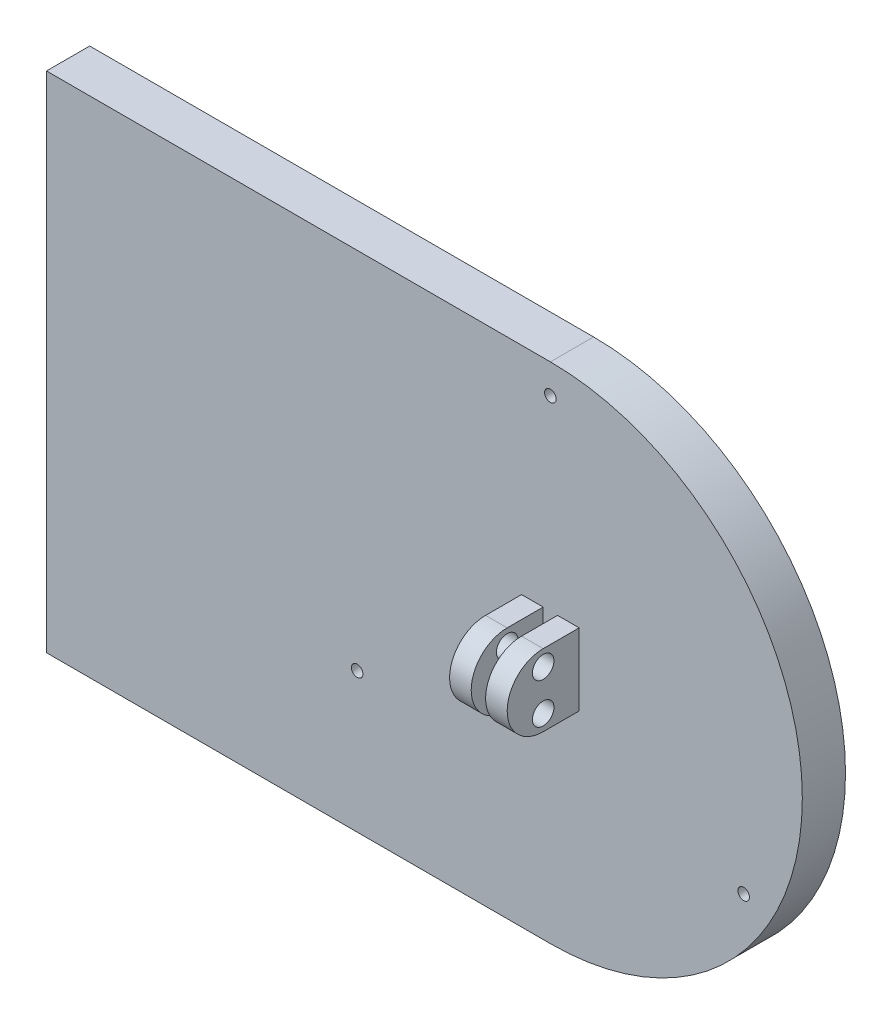
from build123d import *

# Parameters (mm, degrees)
SKETCH2_R           = 35
BOSS_EXTRUDE1_DEPTH = 6
SKETCH8_W           = 70
SKETCH8_H           = 70
BOSS_EXTRUDE3_DEPTH = 6
SKETCH3_R           = 0.8
CUT_EXTRUDE1_DEPTH  = 6
SKETCH4_R           = 0.6
CUT_EXTRUDE2_DEPTH  = 6
SKETCH5_W           = 3
SKETCH5_H           = 10
BOSS_EXTRUDE2_DEPTH = 10
CUT_EXTRUDE3_DEPTH  = 84.408632647
SKETCH7_R           = 1.5
CUT_EXTRUDE4_DEPTH  = 84.408632647


with BuildPart() as part:
    # Sketch2 → Boss-Extrude1 (new body)
    with BuildSketch(Plane.XY):
        Circle(SKETCH2_R)
    extrude(amount=BOSS_EXTRUDE1_DEPTH)

    # Sketch8 → Boss-Extrude3 (add)
    with BuildSketch(Plane(origin=(0, 0, 0), x_dir=(-1, 0, 0), z_dir=(0, 0, -1))):
        with Locations((35, 0)):
            Rectangle(SKETCH8_W, SKETCH8_H)
    extrude(amount=-BOSS_EXTRUDE3_DEPTH)

    # Sketch3 → Cut-Extrude1 (cut)
    with BuildSketch(Plane.XY.offset(6)):
        with Locations((0, 30.914278185)):
            Circle(SKETCH3_R)
        with Locations((26.846787517, -15.585721815)):
            Circle(SKETCH3_R)
        with Locations((-26.846787517, -15.585721815)):
            Circle(SKETCH3_R)
    extrude(amount=-CUT_EXTRUDE1_DEPTH, mode=Mode.SUBTRACT)

    # Sketch4 → Cut-Extrude2 (cut)
    with BuildSketch(Plane.XY.offset(6)):
        Circle(SKETCH4_R)
    extrude(amount=-CUT_EXTRUDE2_DEPTH, mode=Mode.SUBTRACT)

    # Sketch5 → Boss-Extrude2 (add)
    with BuildSketch(Plane.XY.offset(6)):
        with Locations((2.5, 0)):
            Rectangle(SKETCH5_W, SKETCH5_H)
        with Locations((-2.5, 0)):
            Rectangle(SKETCH5_W, SKETCH5_H)
    extrude(amount=BOSS_EXTRUDE2_DEPTH)

    # Sketch6 → Cut-Extrude3 (cut, through all)
    with BuildSketch(Plane(origin=(4, 0, 0), x_dir=(0, 0, -1), z_dir=(1, 0, 0))):
        with BuildLine():
            ThreePointArc((-16, 0), (-14.535533906, 3.535533906), (-11, 5))
            Line((-11, 5), (-16, 5))
            Line((-16, 5), (-16, 0))
        make_face()
        with BuildLine():
            ThreePointArc((-11, -5), (-14.535533906, -3.535533906), (-16, 0))
            Line((-16, 0), (-16, -5))
            Line((-16, -5), (-11, -5))
        make_face()
    extrude(amount=-CUT_EXTRUDE3_DEPTH, mode=Mode.SUBTRACT)

    # Sketch7 → Cut-Extrude4 (cut, through all)
    with BuildSketch(Plane(origin=(4, 0, 0), x_dir=(0, 0, -1), z_dir=(1, 0, 0))):
        with Locations(Location((-11, 2.8, 0), (0, 0, 90))):
            Circle(SKETCH7_R)
        with Locations(Location((-11, -2.8, 0), (0, 0, 90))):
            Circle(SKETCH7_R)
    extrude(amount=-CUT_EXTRUDE4_DEPTH, mode=Mode.SUBTRACT)


solid = part.part
